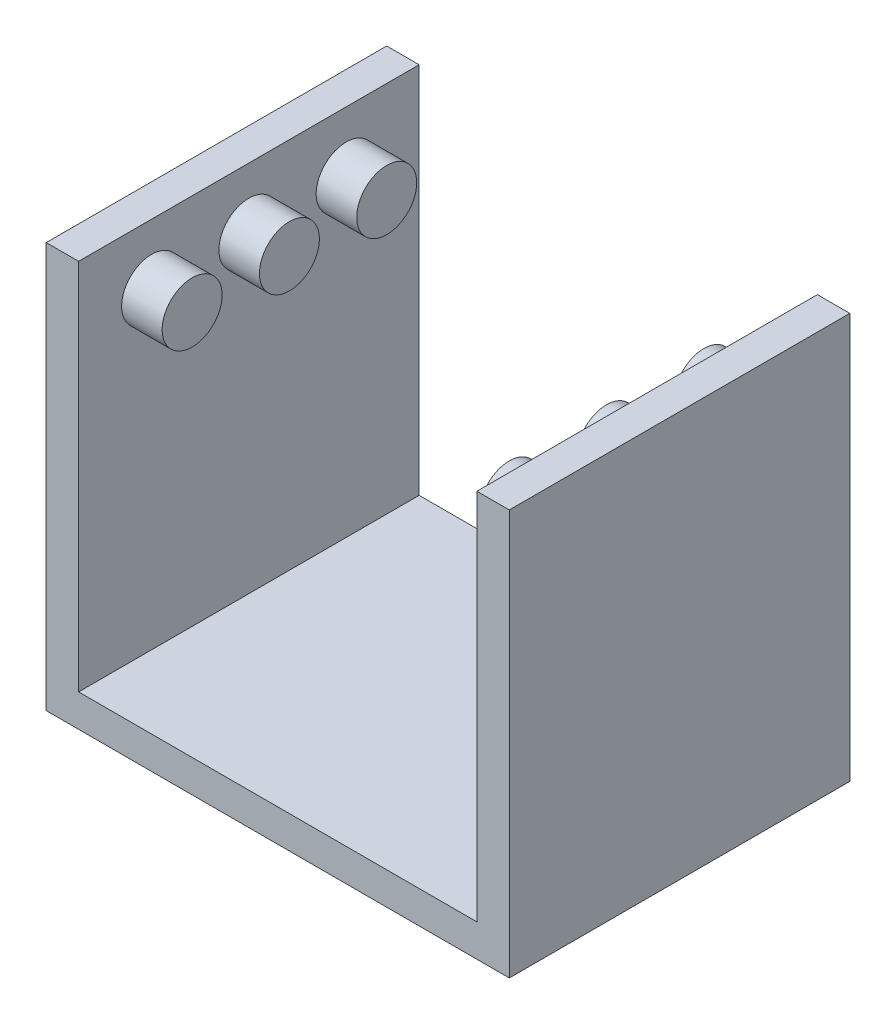
from build123d import *

# Parameters (mm, degrees)
BOSS_EXTRUDE4_DEPTH   = 21
SKETCH5_R             = 1.85
BOSS_EXTRUDE5_DEPTH   = 2.5
BOSS_EXTRUDE5_2_DEPTH = 2.5
BOSS_EXTRUDE5_3_DEPTH = 2.5
SKETCH6_R             = 1.85
BOSS_EXTRUDE6_DEPTH   = 2.5


with BuildPart() as part:
    # Sketch1 → Boss-Extrude4 (new body)
    with BuildSketch(Plane.XY):
        Polygon((12.320696932, -20.271970514), (14.320696932, -20.271970514), (14.320696932, -45.271970514), (-14.239524115, -45.271970514), (-14.239524115, -20.271970514), (-12.239524115, -20.271970514), (-12.239524115, -43.271970514), (12.320696932, -43.271970514), align=None)
    extrude(amount=-BOSS_EXTRUDE4_DEPTH)

    # Sketch6 → Boss-Extrude6 (add)
    with BuildSketch(Plane(origin=(12.320696932, 0, -12.320696932), x_dir=(0, 0, 1), z_dir=(-1, 0, 0))):
        with Locations(Location((7.820696932, -24, 0), (0, 0, 180))):
            Circle(SKETCH6_R)
        with Locations(Location((1.820696932, -24, 0), (0, 0, 180))):
            Circle(SKETCH6_R)
        with Locations(Location((-4.179303068, -24, 0), (0, 0, 180))):
            Circle(SKETCH6_R)
    extrude(amount=BOSS_EXTRUDE6_DEPTH)


with BuildPart() as body_2:
    # Sketch5 → Boss-Extrude5 (new body)
    with BuildSketch(Plane(origin=(-12.239524115, 0, 0), x_dir=(0, 0, -1), z_dir=(1, 0, 0))):
        with Locations((16.5, -24)):
            Circle(SKETCH5_R)
    extrude(amount=BOSS_EXTRUDE5_DEPTH)


with BuildPart() as body_3:
    # Sketch5 → Boss-Extrude5 2 (new body)
    with BuildSketch(Plane(origin=(-12.239524115, 0, 0), x_dir=(0, 0, -1), z_dir=(1, 0, 0))):
        with Locations((10.5, -24)):
            Circle(SKETCH5_R)
    extrude(amount=BOSS_EXTRUDE5_2_DEPTH)


with BuildPart() as body_4:
    # Sketch5 → Boss-Extrude5 3 (new body)
    with BuildSketch(Plane(origin=(-12.239524115, 0, 0), x_dir=(0, 0, -1), z_dir=(1, 0, 0))):
        with Locations((4.5, -24)):
            Circle(SKETCH5_R)
    extrude(amount=BOSS_EXTRUDE5_3_DEPTH)


solid = Compound([part.part, body_2.part, body_3.part, body_4.part])
